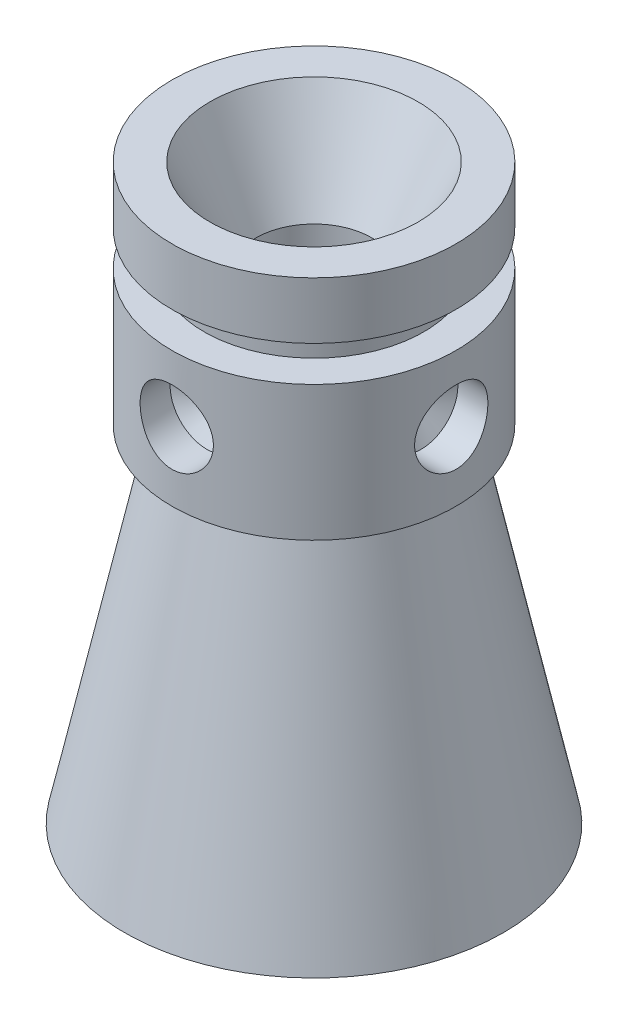
from build123d import *

# Parameters (mm, degrees)
CIRPATTERN1_COUNT = 4


with BuildPart() as part:
    # Sketch1 → Body (revolve)
    with BuildSketch(Plane.XY):
        Polygon((-12.7, -38.416258567), (-10.16, -38.416258567), (-3.884, -8.89), (-3.884, -6.35), (-6.985, 0), (-9.525, 0), (-9.525, -3.81), (-7.366, -3.81), (-7.366, -6.19125), (-9.525, -6.19125), (-9.525, -15.24), (-7.773734167, -15.24), align=None)
    revolve(axis=Axis((0, 0, 0), (0, -1, 0)))

    # Sketch4 → SetScrew (revolve, cut)
    with BuildSketch(Plane(origin=(-9.525, -10.63625, 0), x_dir=(0, 0, 1), z_dir=(0, 1, 0))):
        Polygon((0, 0), (0, 3.81), (2.45745, 2.333415072), (2.45745, 0), align=None)
    setscrew = revolve(axis=Axis((-15.875, -10.63625, 0), (1, 0, 0)), mode=Mode.SUBTRACT)

    # CirPattern1: SetScrew ×4 about axis
    cirpattern1_axis = Axis((0, 0, 0), (0, 1, 0))
    for i in range(1, CIRPATTERN1_COUNT):
        add(setscrew.rotate(cirpattern1_axis, i * 360 / CIRPATTERN1_COUNT), mode=Mode.SUBTRACT)


solid = part.part
